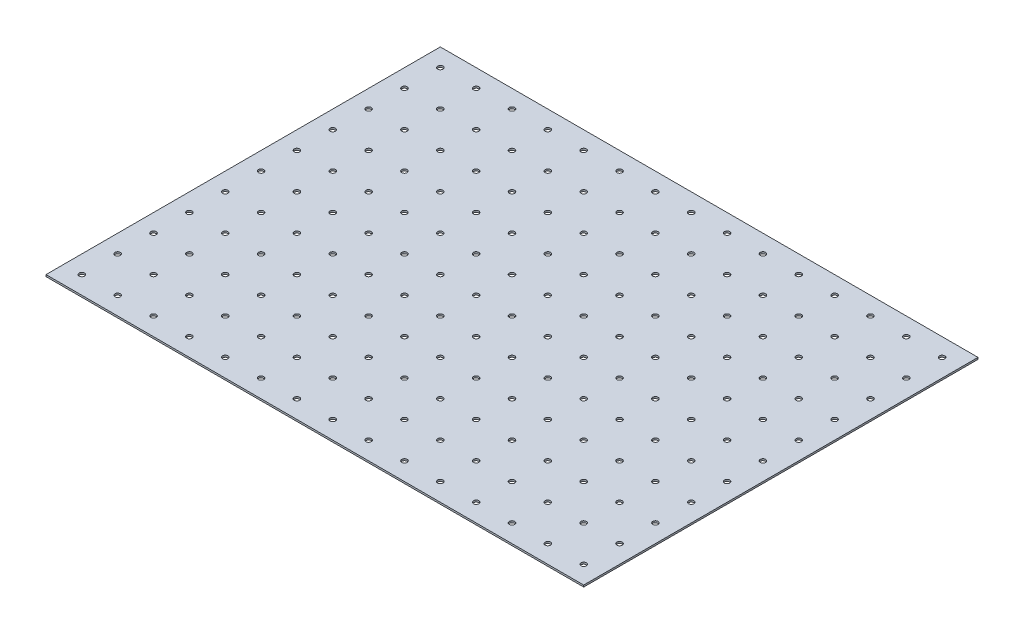
from build123d import *

# Parameters (mm, degrees)
SKETCH1_W           = 300
SKETCH1_H           = 220
BOSS_EXTRUDE1_DEPTH = 1
SKETCH2_R           = 1.5
CUT_EXTRUDE1_DEPTH  = 10


with BuildPart() as part:
    # Sketch1 → Boss-Extrude1 (new body)
    with BuildSketch(Plane(origin=(0, 0, 0), x_dir=(1, 0, 0), z_dir=(0, 1, 0))):
        with Locations((-150, 110)):
            Rectangle(SKETCH1_W, SKETCH1_H)
    extrude(amount=BOSS_EXTRUDE1_DEPTH)

    # Sketch2 → Cut-Extrude1 (cut)
    with BuildSketch(Plane(origin=(0, 1, 0), x_dir=(1, 0, 0), z_dir=(0, 1, 0))):
        with Locations(Location((-290, 210, 0), (0, 0, 270))):
            Circle(SKETCH2_R)
        with Locations(Location((-270, 210, 0), (0, 0, 270))):
            Circle(SKETCH2_R)
        with Locations(Location((-250, 210, 0), (0, 0, 270))):
            Circle(SKETCH2_R)
        with Locations(Location((-230, 210, 0), (0, 0, 270))):
            Circle(SKETCH2_R)
        with Locations(Location((-210, 210, 0), (0, 0, 270))):
            Circle(SKETCH2_R)
        with Locations(Location((-190, 210, 0), (0, 0, 270))):
            Circle(SKETCH2_R)
        with Locations(Location((-170, 210, 0), (0, 0, 270))):
            Circle(SKETCH2_R)
        with Locations(Location((-150, 210, 0), (0, 0, 270))):
            Circle(SKETCH2_R)
        with Locations(Location((-130, 210, 0), (0, 0, 270))):
            Circle(SKETCH2_R)
        with Locations(Location((-110, 210, 0), (0, 0, 270))):
            Circle(SKETCH2_R)
        with Locations(Location((-90, 210, 0), (0, 0, 270))):
            Circle(SKETCH2_R)
        with Locations(Location((-70, 210, 0), (0, 0, 270))):
            Circle(SKETCH2_R)
        with Locations(Location((-50, 210, 0), (0, 0, 270))):
            Circle(SKETCH2_R)
        with Locations(Location((-30, 210, 0), (0, 0, 270))):
            Circle(SKETCH2_R)
        with Locations(Location((-10, 210, 0), (0, 0, 270))):
            Circle(SKETCH2_R)
        with Locations(Location((-290, 190, 0), (0, 0, 270))):
            Circle(SKETCH2_R)
        with Locations(Location((-270, 190, 0), (0, 0, 270))):
            Circle(SKETCH2_R)
        with Locations(Location((-250, 190, 0), (0, 0, 270))):
            Circle(SKETCH2_R)
        with Locations(Location((-230, 190, 0), (0, 0, 270))):
            Circle(SKETCH2_R)
        with Locations(Location((-210, 190, 0), (0, 0, 270))):
            Circle(SKETCH2_R)
        with Locations(Location((-190, 190, 0), (0, 0, 270))):
            Circle(SKETCH2_R)
        with Locations(Location((-170, 190, 0), (0, 0, 270))):
            Circle(SKETCH2_R)
        with Locations(Location((-150, 190, 0), (0, 0, 270))):
            Circle(SKETCH2_R)
        with Locations(Location((-130, 190, 0), (0, 0, 270))):
            Circle(SKETCH2_R)
        with Locations(Location((-110, 190, 0), (0, 0, 270))):
            Circle(SKETCH2_R)
        with Locations(Location((-90, 190, 0), (0, 0, 270))):
            Circle(SKETCH2_R)
        with Locations(Location((-70, 190, 0), (0, 0, 270))):
            Circle(SKETCH2_R)
        with Locations(Location((-50, 190, 0), (0, 0, 270))):
            Circle(SKETCH2_R)
        with Locations(Location((-30, 190, 0), (0, 0, 270))):
            Circle(SKETCH2_R)
        with Locations(Location((-10, 190, 0), (0, 0, 270))):
            Circle(SKETCH2_R)
        with Locations(Location((-290, 170, 0), (0, 0, 270))):
            Circle(SKETCH2_R)
        with Locations(Location((-270, 170, 0), (0, 0, 270))):
            Circle(SKETCH2_R)
        with Locations(Location((-250, 170, 0), (0, 0, 270))):
            Circle(SKETCH2_R)
        with Locations(Location((-230, 170, 0), (0, 0, 270))):
            Circle(SKETCH2_R)
        with Locations(Location((-210, 170, 0), (0, 0, 270))):
            Circle(SKETCH2_R)
        with Locations(Location((-190, 170, 0), (0, 0, 270))):
            Circle(SKETCH2_R)
        with Locations(Location((-170, 170, 0), (0, 0, 270))):
            Circle(SKETCH2_R)
        with Locations(Location((-150, 170, 0), (0, 0, 270))):
            Circle(SKETCH2_R)
        with Locations(Location((-130, 170, 0), (0, 0, 270))):
            Circle(SKETCH2_R)
        with Locations(Location((-110, 170, 0), (0, 0, 270))):
            Circle(SKETCH2_R)
        with Locations(Location((-90, 170, 0), (0, 0, 270))):
            Circle(SKETCH2_R)
        with Locations(Location((-70, 170, 0), (0, 0, 270))):
            Circle(SKETCH2_R)
        with Locations(Location((-50, 170, 0), (0, 0, 270))):
            Circle(SKETCH2_R)
        with Locations(Location((-30, 170, 0), (0, 0, 270))):
            Circle(SKETCH2_R)
        with Locations(Location((-10, 170, 0), (0, 0, 270))):
            Circle(SKETCH2_R)
        with Locations(Location((-290, 150, 0), (0, 0, 270))):
            Circle(SKETCH2_R)
        with Locations(Location((-270, 150, 0), (0, 0, 270))):
            Circle(SKETCH2_R)
        with Locations(Location((-250, 150, 0), (0, 0, 270))):
            Circle(SKETCH2_R)
        with Locations(Location((-230, 150, 0), (0, 0, 270))):
            Circle(SKETCH2_R)
        with Locations(Location((-210, 150, 0), (0, 0, 270))):
            Circle(SKETCH2_R)
        with Locations(Location((-190, 150, 0), (0, 0, 270))):
            Circle(SKETCH2_R)
        with Locations(Location((-170, 150, 0), (0, 0, 270))):
            Circle(SKETCH2_R)
        with Locations(Location((-150, 150, 0), (0, 0, 270))):
            Circle(SKETCH2_R)
        with Locations(Location((-130, 150, 0), (0, 0, 270))):
            Circle(SKETCH2_R)
        with Locations(Location((-110, 150, 0), (0, 0, 270))):
            Circle(SKETCH2_R)
        with Locations(Location((-90, 150, 0), (0, 0, 270))):
            Circle(SKETCH2_R)
        with Locations(Location((-70, 150, 0), (0, 0, 270))):
            Circle(SKETCH2_R)
        with Locations(Location((-50, 150, 0), (0, 0, 270))):
            Circle(SKETCH2_R)
        with Locations(Location((-30, 150, 0), (0, 0, 270))):
            Circle(SKETCH2_R)
        with Locations(Location((-10, 150, 0), (0, 0, 270))):
            Circle(SKETCH2_R)
        with Locations(Location((-290, 130, 0), (0, 0, 270))):
            Circle(SKETCH2_R)
        with Locations(Location((-270, 130, 0), (0, 0, 270))):
            Circle(SKETCH2_R)
        with Locations(Location((-250, 130, 0), (0, 0, 270))):
            Circle(SKETCH2_R)
        with Locations(Location((-230, 130, 0), (0, 0, 270))):
            Circle(SKETCH2_R)
        with Locations(Location((-210, 130, 0), (0, 0, 270))):
            Circle(SKETCH2_R)
        with Locations(Location((-190, 130, 0), (0, 0, 270))):
            Circle(SKETCH2_R)
        with Locations(Location((-170, 130, 0), (0, 0, 270))):
            Circle(SKETCH2_R)
        with Locations(Location((-150, 130, 0), (0, 0, 270))):
            Circle(SKETCH2_R)
        with Locations(Location((-130, 130, 0), (0, 0, 270))):
            Circle(SKETCH2_R)
        with Locations(Location((-110, 130, 0), (0, 0, 270))):
            Circle(SKETCH2_R)
        with Locations(Location((-90, 130, 0), (0, 0, 270))):
            Circle(SKETCH2_R)
        with Locations(Location((-70, 130, 0), (0, 0, 270))):
            Circle(SKETCH2_R)
        with Locations(Location((-50, 130, 0), (0, 0, 270))):
            Circle(SKETCH2_R)
        with Locations(Location((-30, 130, 0), (0, 0, 270))):
            Circle(SKETCH2_R)
        with Locations(Location((-10, 130, 0), (0, 0, 270))):
            Circle(SKETCH2_R)
        with Locations(Location((-290, 110, 0), (0, 0, 270))):
            Circle(SKETCH2_R)
        with Locations(Location((-270, 110, 0), (0, 0, 270))):
            Circle(SKETCH2_R)
        with Locations(Location((-250, 110, 0), (0, 0, 270))):
            Circle(SKETCH2_R)
        with Locations(Location((-230, 110, 0), (0, 0, 270))):
            Circle(SKETCH2_R)
        with Locations(Location((-210, 110, 0), (0, 0, 270))):
            Circle(SKETCH2_R)
        with Locations(Location((-190, 110, 0), (0, 0, 270))):
            Circle(SKETCH2_R)
        with Locations(Location((-170, 110, 0), (0, 0, 270))):
            Circle(SKETCH2_R)
        with Locations(Location((-150, 110, 0), (0, 0, 270))):
            Circle(SKETCH2_R)
        with Locations(Location((-130, 110, 0), (0, 0, 270))):
            Circle(SKETCH2_R)
        with Locations(Location((-110, 110, 0), (0, 0, 270))):
            Circle(SKETCH2_R)
        with Locations(Location((-90, 110, 0), (0, 0, 270))):
            Circle(SKETCH2_R)
        with Locations(Location((-70, 110, 0), (0, 0, 270))):
            Circle(SKETCH2_R)
        with Locations(Location((-50, 110, 0), (0, 0, 270))):
            Circle(SKETCH2_R)
        with Locations(Location((-30, 110, 0), (0, 0, 270))):
            Circle(SKETCH2_R)
        with Locations(Location((-10, 110, 0), (0, 0, 270))):
            Circle(SKETCH2_R)
        with Locations(Location((-290, 90, 0), (0, 0, 270))):
            Circle(SKETCH2_R)
        with Locations(Location((-270, 90, 0), (0, 0, 270))):
            Circle(SKETCH2_R)
        with Locations(Location((-250, 90, 0), (0, 0, 270))):
            Circle(SKETCH2_R)
        with Locations(Location((-230, 90, 0), (0, 0, 270))):
            Circle(SKETCH2_R)
        with Locations(Location((-210, 90, 0), (0, 0, 270))):
            Circle(SKETCH2_R)
        with Locations(Location((-190, 90, 0), (0, 0, 270))):
            Circle(SKETCH2_R)
        with Locations(Location((-170, 90, 0), (0, 0, 270))):
            Circle(SKETCH2_R)
        with Locations(Location((-150, 90, 0), (0, 0, 270))):
            Circle(SKETCH2_R)
        with Locations(Location((-130, 90, 0), (0, 0, 270))):
            Circle(SKETCH2_R)
        with Locations(Location((-110, 90, 0), (0, 0, 270))):
            Circle(SKETCH2_R)
        with Locations(Location((-90, 90, 0), (0, 0, 270))):
            Circle(SKETCH2_R)
        with Locations(Location((-70, 90, 0), (0, 0, 270))):
            Circle(SKETCH2_R)
        with Locations(Location((-50, 90, 0), (0, 0, 270))):
            Circle(SKETCH2_R)
        with Locations(Location((-30, 90, 0), (0, 0, 270))):
            Circle(SKETCH2_R)
        with Locations(Location((-10, 90, 0), (0, 0, 270))):
            Circle(SKETCH2_R)
        with Locations(Location((-290, 70, 0), (0, 0, 270))):
            Circle(SKETCH2_R)
        with Locations(Location((-270, 70, 0), (0, 0, 270))):
            Circle(SKETCH2_R)
        with Locations(Location((-250, 70, 0), (0, 0, 270))):
            Circle(SKETCH2_R)
        with Locations(Location((-230, 70, 0), (0, 0, 270))):
            Circle(SKETCH2_R)
        with Locations(Location((-210, 70, 0), (0, 0, 270))):
            Circle(SKETCH2_R)
        with Locations(Location((-190, 70, 0), (0, 0, 270))):
            Circle(SKETCH2_R)
        with Locations(Location((-170, 70, 0), (0, 0, 270))):
            Circle(SKETCH2_R)
        with Locations(Location((-150, 70, 0), (0, 0, 270))):
            Circle(SKETCH2_R)
        with Locations(Location((-130, 70, 0), (0, 0, 270))):
            Circle(SKETCH2_R)
        with Locations(Location((-110, 70, 0), (0, 0, 270))):
            Circle(SKETCH2_R)
        with Locations(Location((-90, 70, 0), (0, 0, 270))):
            Circle(SKETCH2_R)
        with Locations(Location((-70, 70, 0), (0, 0, 270))):
            Circle(SKETCH2_R)
        with Locations(Location((-50, 70, 0), (0, 0, 270))):
            Circle(SKETCH2_R)
        with Locations(Location((-30, 70, 0), (0, 0, 270))):
            Circle(SKETCH2_R)
        with Locations(Location((-10, 70, 0), (0, 0, 270))):
            Circle(SKETCH2_R)
        with Locations(Location((-290, 50, 0), (0, 0, 270))):
            Circle(SKETCH2_R)
        with Locations(Location((-270, 50, 0), (0, 0, 270))):
            Circle(SKETCH2_R)
        with Locations(Location((-250, 50, 0), (0, 0, 270))):
            Circle(SKETCH2_R)
        with Locations(Location((-230, 50, 0), (0, 0, 270))):
            Circle(SKETCH2_R)
        with Locations(Location((-210, 50, 0), (0, 0, 270))):
            Circle(SKETCH2_R)
        with Locations(Location((-190, 50, 0), (0, 0, 270))):
            Circle(SKETCH2_R)
        with Locations(Location((-170, 50, 0), (0, 0, 270))):
            Circle(SKETCH2_R)
        with Locations(Location((-150, 50, 0), (0, 0, 270))):
            Circle(SKETCH2_R)
        with Locations(Location((-130, 50, 0), (0, 0, 270))):
            Circle(SKETCH2_R)
        with Locations(Location((-110, 50, 0), (0, 0, 270))):
            Circle(SKETCH2_R)
        with Locations(Location((-90, 50, 0), (0, 0, 270))):
            Circle(SKETCH2_R)
        with Locations(Location((-70, 50, 0), (0, 0, 270))):
            Circle(SKETCH2_R)
        with Locations(Location((-50, 50, 0), (0, 0, 270))):
            Circle(SKETCH2_R)
        with Locations(Location((-30, 50, 0), (0, 0, 270))):
            Circle(SKETCH2_R)
        with Locations(Location((-10, 50, 0), (0, 0, 270))):
            Circle(SKETCH2_R)
        with Locations(Location((-290, 30, 0), (0, 0, 270))):
            Circle(SKETCH2_R)
        with Locations(Location((-270, 30, 0), (0, 0, 270))):
            Circle(SKETCH2_R)
        with Locations(Location((-250, 30, 0), (0, 0, 270))):
            Circle(SKETCH2_R)
        with Locations(Location((-230, 30, 0), (0, 0, 270))):
            Circle(SKETCH2_R)
        with Locations(Location((-210, 30, 0), (0, 0, 270))):
            Circle(SKETCH2_R)
        with Locations(Location((-190, 30, 0), (0, 0, 270))):
            Circle(SKETCH2_R)
        with Locations(Location((-170, 30, 0), (0, 0, 270))):
            Circle(SKETCH2_R)
        with Locations(Location((-150, 30, 0), (0, 0, 270))):
            Circle(SKETCH2_R)
        with Locations(Location((-130, 30, 0), (0, 0, 270))):
            Circle(SKETCH2_R)
        with Locations(Location((-110, 30, 0), (0, 0, 270))):
            Circle(SKETCH2_R)
        with Locations(Location((-90, 30, 0), (0, 0, 270))):
            Circle(SKETCH2_R)
        with Locations(Location((-70, 30, 0), (0, 0, 270))):
            Circle(SKETCH2_R)
        with Locations(Location((-50, 30, 0), (0, 0, 270))):
            Circle(SKETCH2_R)
        with Locations(Location((-30, 30, 0), (0, 0, 270))):
            Circle(SKETCH2_R)
        with Locations(Location((-10, 30, 0), (0, 0, 270))):
            Circle(SKETCH2_R)
        with Locations(Location((-290, 10, 0), (0, 0, 270))):
            Circle(SKETCH2_R)
        with Locations(Location((-270, 10, 0), (0, 0, 270))):
            Circle(SKETCH2_R)
        with Locations(Location((-250, 10, 0), (0, 0, 270))):
            Circle(SKETCH2_R)
        with Locations(Location((-230, 10, 0), (0, 0, 270))):
            Circle(SKETCH2_R)
        with Locations(Location((-210, 10, 0), (0, 0, 270))):
            Circle(SKETCH2_R)
        with Locations(Location((-190, 10, 0), (0, 0, 270))):
            Circle(SKETCH2_R)
        with Locations(Location((-170, 10, 0), (0, 0, 270))):
            Circle(SKETCH2_R)
        with Locations(Location((-150, 10, 0), (0, 0, 270))):
            Circle(SKETCH2_R)
        with Locations(Location((-130, 10, 0), (0, 0, 270))):
            Circle(SKETCH2_R)
        with Locations(Location((-110, 10, 0), (0, 0, 270))):
            Circle(SKETCH2_R)
        with Locations(Location((-90, 10, 0), (0, 0, 270))):
            Circle(SKETCH2_R)
        with Locations(Location((-70, 10, 0), (0, 0, 270))):
            Circle(SKETCH2_R)
        with Locations(Location((-50, 10, 0), (0, 0, 270))):
            Circle(SKETCH2_R)
        with Locations(Location((-30, 10, 0), (0, 0, 270))):
            Circle(SKETCH2_R)
        with Locations(Location((-10, 10, 0), (0, 0, 270))):
            Circle(SKETCH2_R)
    extrude(amount=-CUT_EXTRUDE1_DEPTH, mode=Mode.SUBTRACT)


solid = part.part
